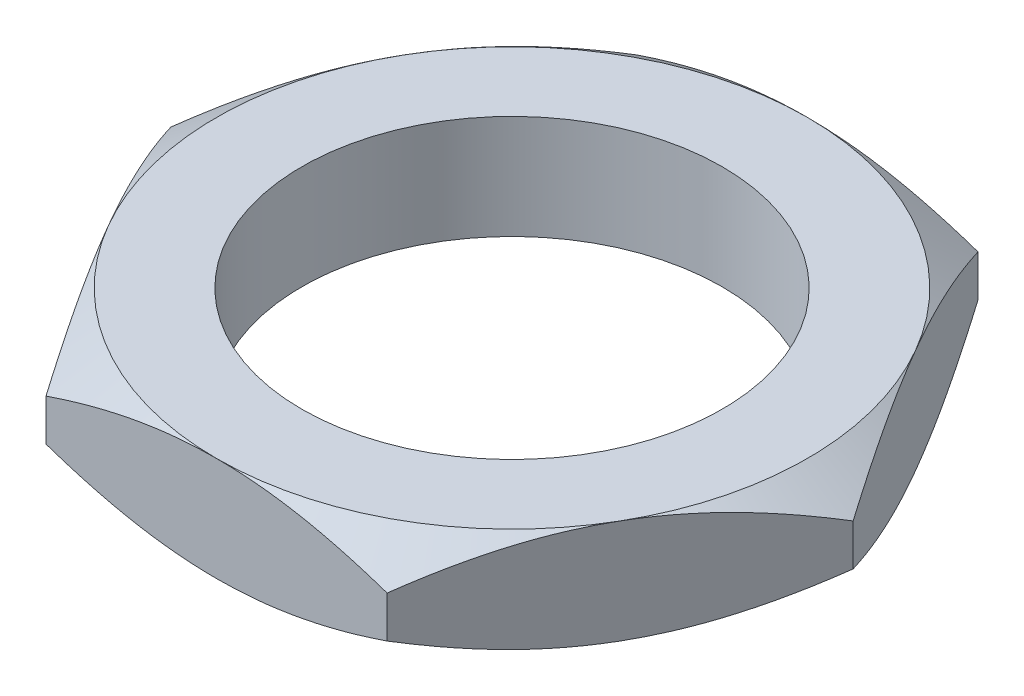
from build123d import *

# Parameters (mm, degrees)
SKIZZE1_R                       = 5.05
AUFSATZ_LINEAR_AUSTRAGEN1_DEPTH = 2.5


with BuildPart() as part:
    # Skizze1 → Aufsatz-Linear austragen1 (new body)
    with BuildSketch(Plane(origin=(0, 0, 0), x_dir=(1, 0, 0), z_dir=(0, 1, 0))):
        Polygon((8.198373822, 0), (4.099186911, 7.1), (-4.099186911, 7.1), (-8.198373822, 0), (-4.099186911, -7.1), (4.099186911, -7.1), align=None)
        with Locations(Location((0, 0, 0), (0, 0, 270))):
            Circle(SKIZZE1_R, mode=Mode.SUBTRACT)
    extrude(amount=AUFSATZ_LINEAR_AUSTRAGEN1_DEPTH)

    # Skizze4 → Schnitt-Rotation1 (revolve, cut)
    with BuildSketch(Plane(origin=(0, 0, 0), x_dir=(0.49999999999999506, 0, -0.8660254037844415), z_dir=(0.8660254037844415, 0, 0.49999999999999506))):
        Polygon((-8.198373822, 0.75), (-7.1, 0), (-8.198373822, 0), align=None)
    schnitt_rotation1 = revolve(axis=Axis((0, 0, 0), (0, 1, 0)), mode=Mode.SUBTRACT)

    # Spiegeln1: Schnitt-Rotation1 across plane
    add(schnitt_rotation1.mirror(Plane.ZX.offset(1.25)), mode=Mode.SUBTRACT)


solid = part.part
